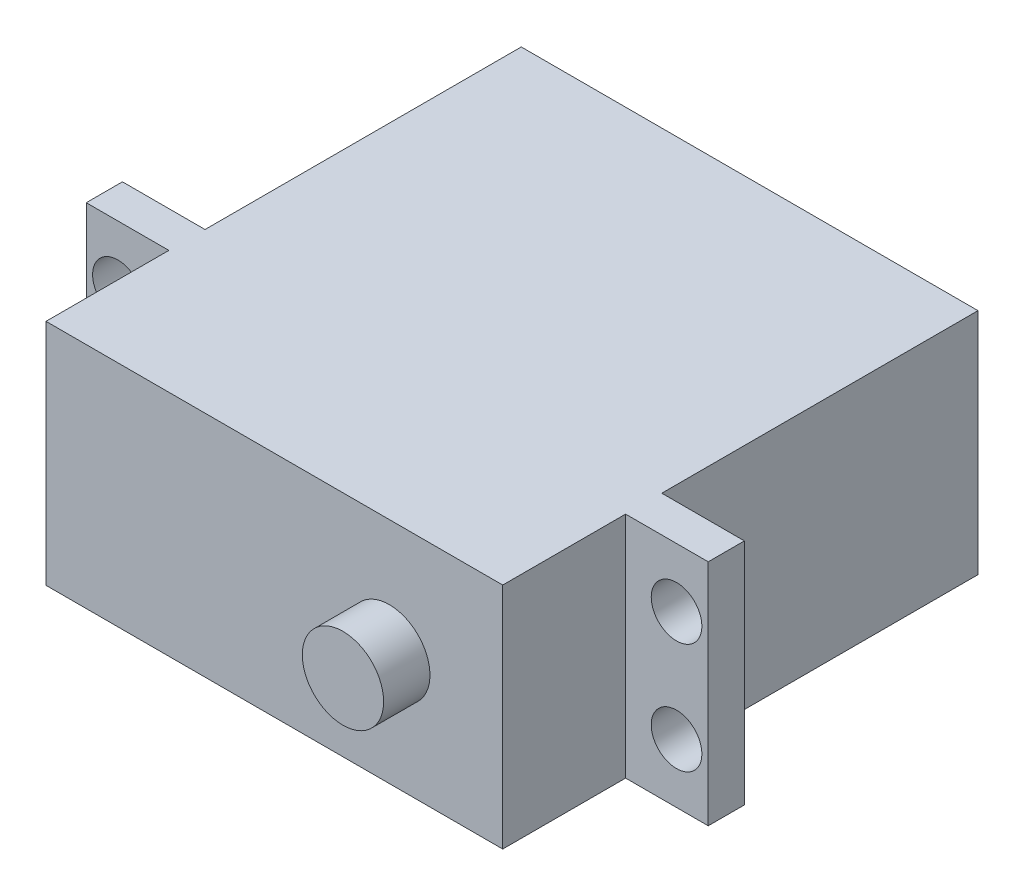
from build123d import *

# Parameters (mm, degrees)
SKETCH1_W           = 40.0812
SKETCH1_H           = 20.066
BOSS_EXTRUDE1_DEPTH = 41.7068
SKETCH2_W           = 3.175
SKETCH2_H           = 20.066
BOSS_EXTRUDE2_DEPTH = 7.25
CUT_EXTRUDE1_REACH  = 61.993
SKETCH3_R           = 2.2225
SKETCH4_R           = 3.5687
BOSS_EXTRUDE3_DEPTH = 4.064


with BuildPart() as part:
    # Sketch1 → Boss-Extrude1 (new body)
    with BuildSketch(Plane.XY):
        with Locations((20.0406, 10.033)):
            Rectangle(SKETCH1_W, SKETCH1_H)
    extrude(amount=BOSS_EXTRUDE1_DEPTH)

    # Sketch2 → Boss-Extrude2 (add)
    with BuildSketch(Plane(origin=(40.0812, 0, 0), x_dir=(0, 0, -1), z_dir=(1, 0, 0))):
        with Locations((-29.337, 10.033)):
            Rectangle(SKETCH2_W, SKETCH2_H)
    boss_extrude2 = extrude(amount=BOSS_EXTRUDE2_DEPTH)

    # Mirror1: Boss-Extrude2 across plane
    add(boss_extrude2.mirror(Plane.ZY.offset(-20.0406)))

    # Sketch3 → Cut-Extrude1 (cut, up to next)
    with BuildSketch(Plane.XY.offset(30.9245), mode=Mode.PRIVATE) as cut_extrude1_sk1:
        with Locations((44.5516, 5.1816)):
            Circle(SKETCH3_R)
    cut_extrude1_tool1 = extrude(cut_extrude1_sk1.sketch, amount=-CUT_EXTRUDE1_REACH, mode=Mode.PRIVATE) & part.part
    # Sketch3 → Cut-Extrude1 (cut, up to next)
    with BuildSketch(Plane.XY.offset(30.9245), mode=Mode.PRIVATE) as cut_extrude1_sk2:
        with Locations(Location((-4.4704, 5.1816, 0), (0, 0, 180))):
            Circle(SKETCH3_R)
    cut_extrude1_tool2 = extrude(cut_extrude1_sk2.sketch, amount=-CUT_EXTRUDE1_REACH, mode=Mode.PRIVATE) & part.part
    # Sketch3 → Cut-Extrude1 (cut, up to next)
    with BuildSketch(Plane.XY.offset(30.9245), mode=Mode.PRIVATE) as cut_extrude1_sk3:
        with Locations((-4.4704, 14.8844)):
            Circle(SKETCH3_R)
    cut_extrude1_tool3 = extrude(cut_extrude1_sk3.sketch, amount=-CUT_EXTRUDE1_REACH, mode=Mode.PRIVATE) & part.part
    # Sketch3 → Cut-Extrude1 (cut, up to next)
    with BuildSketch(Plane.XY.offset(30.9245), mode=Mode.PRIVATE) as cut_extrude1_sk4:
        with Locations((44.5516, 14.8844)):
            Circle(SKETCH3_R)
    cut_extrude1_tool4 = extrude(cut_extrude1_sk4.sketch, amount=-CUT_EXTRUDE1_REACH, mode=Mode.PRIVATE) & part.part
    add(cut_extrude1_tool1.solids().sort_by_distance((44.5516, 5.1816, 30.9245))[0], mode=Mode.SUBTRACT)
    add(cut_extrude1_tool2.solids().sort_by_distance((-4.4704, 5.1816, 30.9245))[0], mode=Mode.SUBTRACT)
    add(cut_extrude1_tool3.solids().sort_by_distance((-4.4704, 14.8844, 30.9245))[0], mode=Mode.SUBTRACT)
    add(cut_extrude1_tool4.solids().sort_by_distance((44.5516, 14.8844, 30.9245))[0], mode=Mode.SUBTRACT)

    # Sketch4 → Boss-Extrude3 (add)
    with BuildSketch(Plane.XY.offset(41.7068)):
        with Locations(Location((30.1244, 10.033, 0), (0, 0, 180))):
            Circle(SKETCH4_R)
    extrude(amount=BOSS_EXTRUDE3_DEPTH)


solid = part.part
